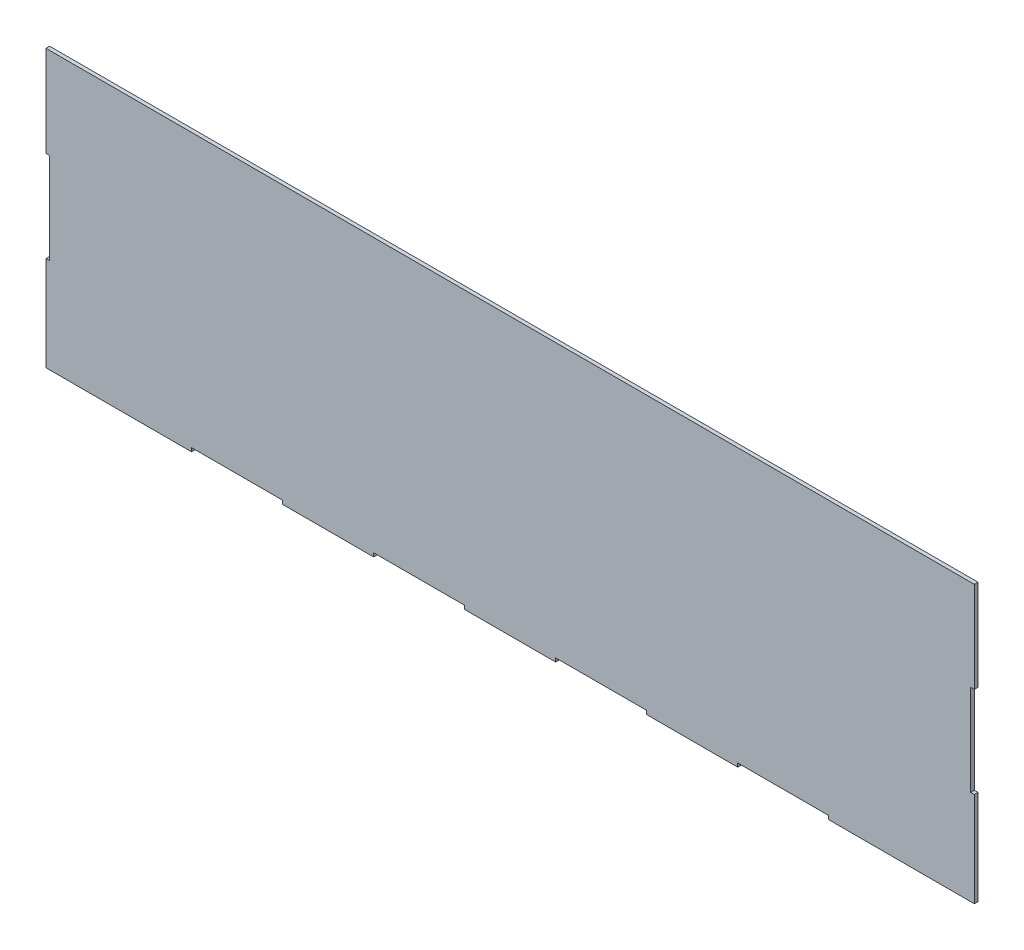
from build123d import *

# Parameters (mm, degrees)
EXTRUDE_1_DEPTH = 4


with BuildPart() as part:
    # 草图1 → 凸台-拉伸1 (new body)
    with BuildSketch(Plane.XY):
        Polygon((878.999456567, 804.966316801), (874.999456567, 804.966316801), (874.999456567, 700.966316801), (1034.999456567, 700.966316801), (1034.999456567, 704.966316801), (1134.999456567, 704.966316801), (1134.999456567, 700.966316801), (1234.999456567, 700.966316801), (1234.999456567, 704.966316801), (1334.999456567, 704.966316801), (1334.999456567, 700.966316801), (1434.999456567, 700.966316801), (1434.999456567, 704.966316801), (1534.999456567, 704.966316801), (1534.999456567, 700.966316801), (1634.999456567, 700.966316801), (1634.999456567, 704.966316801), (1734.999456567, 704.966316801), (1734.999456567, 700.966316801), (1894.999456567, 700.966316801), (1894.999456567, 804.966316801), (1890.999456567, 804.966316801), (1890.999456567, 904.966316801), (1894.999456567, 904.966316801), (1894.999456567, 1004.966316801), (874.999456567, 1004.966316801), (874.999456567, 904.966316801), (878.999456567, 904.966316801), align=None)
    extrude(amount=EXTRUDE_1_DEPTH)


solid = part.part
